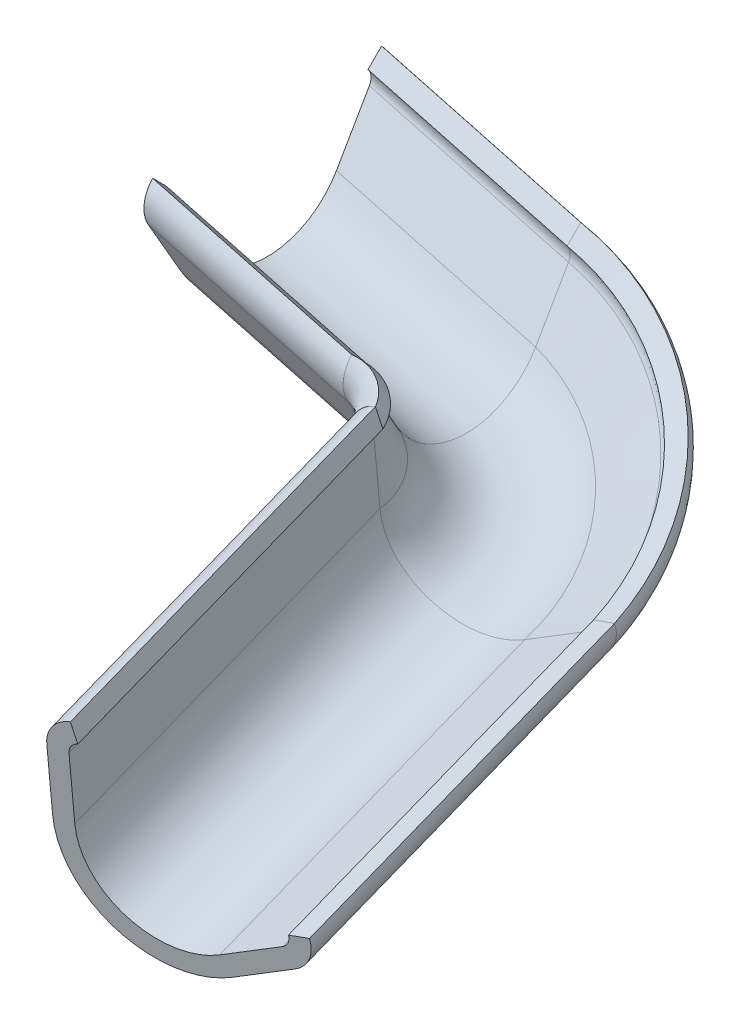
from build123d import *


with BuildPart() as part:
    # 掃出1: sweep along a curve in space
    with BuildLine() as sweep_1_path:
        Line((-6.036351113, 12.796240334, 14.5), (-4.482570466, 12.379905998, 14.499123516))
        ThreePointArc((-3.594149831, 11.855451508, 15.339811777), (-3.860202372, 12.131148392, 14.739597367), (-4.482570466, 12.379905998, 14.499123516))
        Line((-3.594149831, 11.855451508, 15.339811777), (-3.514004927, 10.9958548, 17.801401577))
    # 草圖1 → 掃出1 (sweep)
    with BuildSketch(Plane(origin=(-6.036351113, 0, 0), x_dir=(0, 0, -1), z_dir=(1, 0, 0))):
        with BuildLine():
            Line((-15.393630942, 13.14969517), (-15.287438111, 13.043502339))
            ThreePointArc((-15.287438111, 13.043502339), (-15.311023025, 12.987688145), (-15.298048491, 12.928500866))
            Line((-15.298048491, 12.928500866), (-15.041265877, 12.483740334))
            ThreePointArc((-15.041265877, 12.483740334), (-14.5, 12.171240334), (-13.958734123, 12.483740334))
            Line((-13.958734123, 12.483740334), (-13.701951509, 12.928500866))
            ThreePointArc((-13.701951509, 12.928500866), (-13.688976975, 12.987688145), (-13.712561889, 13.043502339))
            Line((-13.712561889, 13.043502339), (-13.606369058, 13.14969517))
            ThreePointArc((-13.606369058, 13.14969517), (-13.540217783, 13.007275157), (-13.572049672, 12.853502005))
            Line((-13.572049672, 12.853502005), (-13.828832285, 12.408741473))
            ThreePointArc((-13.828832285, 12.408741473), (-14.5, 12.021242612), (-15.171167715, 12.408741473))
            Line((-15.171167715, 12.408741473), (-15.427950328, 12.853502005))
            ThreePointArc((-15.427950328, 12.853502005), (-15.459782217, 13.007275157), (-15.393630942, 13.14969517))
        make_face()
    sweep(path=sweep_1_path.line)


solid = part.part
